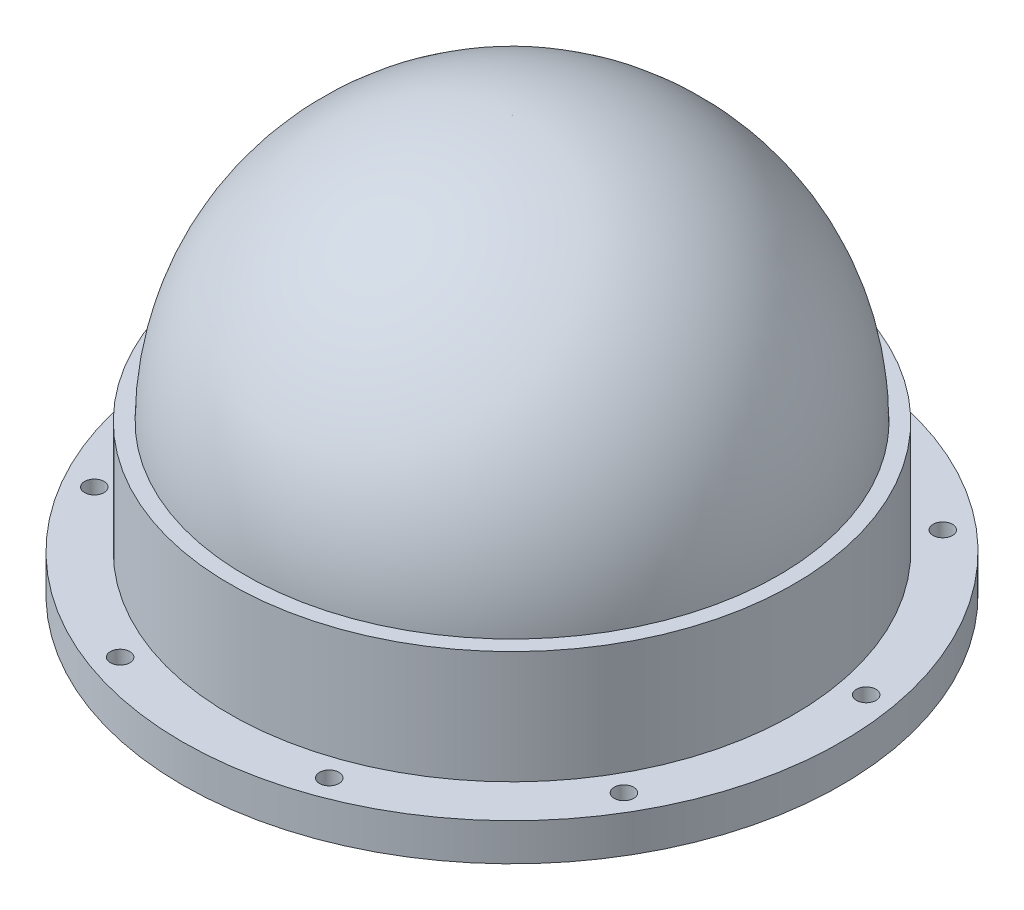
from build123d import *

# Parameters (mm, degrees)
SKETCH4_W                        = 3.3782
SKETCH4_H                        = 12.954
F_1_4_CLEARANCE_HOLE1_AT_2_COUNT = 2
F_1_4_CLEARANCE_HOLE1_AT_2_PITCH = 72.539052198
F_1_4_CLEARANCE_HOLE1_AT_3_COUNT = 2
F_1_4_CLEARANCE_HOLE1_AT_3_PITCH = 136.328824138
F_1_4_CLEARANCE_HOLE1_AT_4_COUNT = 2
F_1_4_CLEARANCE_HOLE1_AT_4_PITCH = 183.675327889
F_1_4_CLEARANCE_HOLE1_AT_5_COUNT = 2
F_1_4_CLEARANCE_HOLE1_AT_5_PITCH = 208.867876336
F_1_4_CLEARANCE_HOLE1_AT_6_COUNT = 2
F_1_4_CLEARANCE_HOLE1_AT_6_PITCH = 208.867876336
F_1_4_CLEARANCE_HOLE1_AT_7_COUNT = 2
F_1_4_CLEARANCE_HOLE1_AT_7_PITCH = 183.675327889
F_1_4_CLEARANCE_HOLE1_AT_8_COUNT = 2
F_1_4_CLEARANCE_HOLE1_AT_8_PITCH = 136.328824138
F_1_4_CLEARANCE_HOLE1_AT_9_COUNT = 2
F_1_4_CLEARANCE_HOLE1_AT_9_PITCH = 72.539052198
SKETCH5_W                        = 0.1
SKETCH5_H                        = 1
BOSS_EXTRUDE1_DEPTH              = 0.1


with BuildPart() as part:
    # Sketch1 → Revolve1 (revolve)
    with BuildSketch(Plane.XY, mode=Mode.PRIVATE) as revolve1_sk:
        Polygon((79.248, 0), (79.248, 36.83), (92.456, 36.83), (92.456, 52.07), (97.79, 52.07), (97.79, 12.954), (114.3, 12.954), (114.3, 0), align=None)
    revolve(revolve1_sk.sketch.rotate(Axis((0, 0, 0), (0, 1, 0)), 90), axis=Axis((0, 0, 0), (0, 1, 0)))

    # Sketch4 → 1/4 Clearance Hole1 (revolve, cut)
    with BuildSketch(Plane(origin=(0, 12.954, -106.045), x_dir=(0, 0, 1), z_dir=(1, 0, 0))):
        with Locations((1.6891, 6.477)):
            Rectangle(SKETCH4_W, SKETCH4_H)
    f_1_4_clearance_hole1 = revolve(axis=Axis((0, 19.304, -106.045), (0, -1, 0)), mode=Mode.SUBTRACT)

    # 1/4 Clearance Hole1 at 2: 1/4 Clearance Hole1 ×2
    with Locations(*[Vector(0.9396926207859279, 0, 0.3420201433256154) * (i * F_1_4_CLEARANCE_HOLE1_AT_2_PITCH) for i in range(1, F_1_4_CLEARANCE_HOLE1_AT_2_COUNT)]):
        add(f_1_4_clearance_hole1, mode=Mode.SUBTRACT)

    # 1/4 Clearance Hole1 at 3: 1/4 Clearance Hole1 ×2
    with Locations(*[Vector(0.7660444431190144, 0, 0.642787609686496) * (i * F_1_4_CLEARANCE_HOLE1_AT_3_PITCH) for i in range(1, F_1_4_CLEARANCE_HOLE1_AT_3_COUNT)]):
        add(f_1_4_clearance_hole1, mode=Mode.SUBTRACT)

    # 1/4 Clearance Hole1 at 4: 1/4 Clearance Hole1 ×2
    with Locations(*[Vector(0.5000000000000492, 0, 0.8660254037844103) * (i * F_1_4_CLEARANCE_HOLE1_AT_4_PITCH) for i in range(1, F_1_4_CLEARANCE_HOLE1_AT_4_COUNT)]):
        add(f_1_4_clearance_hole1, mode=Mode.SUBTRACT)

    # 1/4 Clearance Hole1 at 5: 1/4 Clearance Hole1 ×2
    with Locations(*[Vector(0.1736481776669862, 0, 0.9848077530121983) * (i * F_1_4_CLEARANCE_HOLE1_AT_5_PITCH) for i in range(1, F_1_4_CLEARANCE_HOLE1_AT_5_COUNT)]):
        add(f_1_4_clearance_hole1, mode=Mode.SUBTRACT)

    # 1/4 Clearance Hole1 at 6: 1/4 Clearance Hole1 ×2
    with Locations(*[Vector(-0.1736481776668746, 0, 0.9848077530122179) * (i * F_1_4_CLEARANCE_HOLE1_AT_6_PITCH) for i in range(1, F_1_4_CLEARANCE_HOLE1_AT_6_COUNT)]):
        add(f_1_4_clearance_hole1, mode=Mode.SUBTRACT)

    # 1/4 Clearance Hole1 at 7: 1/4 Clearance Hole1 ×2
    with Locations(*[Vector(-0.4999999999999508, 0, 0.8660254037844671) * (i * F_1_4_CLEARANCE_HOLE1_AT_7_PITCH) for i in range(1, F_1_4_CLEARANCE_HOLE1_AT_7_COUNT)]):
        add(f_1_4_clearance_hole1, mode=Mode.SUBTRACT)

    # 1/4 Clearance Hole1 at 8: 1/4 Clearance Hole1 ×2
    with Locations(*[Vector(-0.7660444431189416, 0, 0.6427876096865829) * (i * F_1_4_CLEARANCE_HOLE1_AT_8_PITCH) for i in range(1, F_1_4_CLEARANCE_HOLE1_AT_8_COUNT)]):
        add(f_1_4_clearance_hole1, mode=Mode.SUBTRACT)

    # 1/4 Clearance Hole1 at 9: 1/4 Clearance Hole1 ×2
    with Locations(*[Vector(-0.9396926207858892, 0, 0.3420201433257214) * (i * F_1_4_CLEARANCE_HOLE1_AT_9_PITCH) for i in range(1, F_1_4_CLEARANCE_HOLE1_AT_9_COUNT)]):
        add(f_1_4_clearance_hole1, mode=Mode.SUBTRACT)


with BuildPart() as body_2:
    # Sketch2 → Revolve2 (revolve)
    with BuildSketch(Plane.XY, mode=Mode.PRIVATE) as revolve2_sk:
        with BuildLine():
            Line((80.01, 56.388), (80.01, 36.83))
            Line((80.01, 36.83), (92.456, 36.83))
            Line((92.456, 36.83), (92.456, 51.562))
            ThreePointArc((92.456, 51.562), (65.376264561, 116.938264561), (0, 144.018))
            Line((0, 144.018), (0, 136.398))
            ThreePointArc((0, 136.398), (56.575613563, 112.963613563), (80.01, 56.388))
        make_face()
    revolve(revolve2_sk.sketch.rotate(Axis((0, 144.018, 0), (0, -1, 0)), 180), axis=Axis((0, 144.018, 0), (0, -1, 0)))

    # Sketch5 → Boss-Extrude1 (add)
    with BuildSketch(Plane(origin=(0, 0, 0), x_dir=(0, 0, -1), z_dir=(1, 0, 0))):
        Polygon((-0.1, 143.018), (-0.1, 144.01794592), (0, 144.018), (0, 143.018), align=None)
        with Locations((0.05, 143.518)):
            Rectangle(SKETCH5_W, SKETCH5_H)
    extrude(amount=BOSS_EXTRUDE1_DEPTH)


solid = Compound([part.part, body_2.part])
